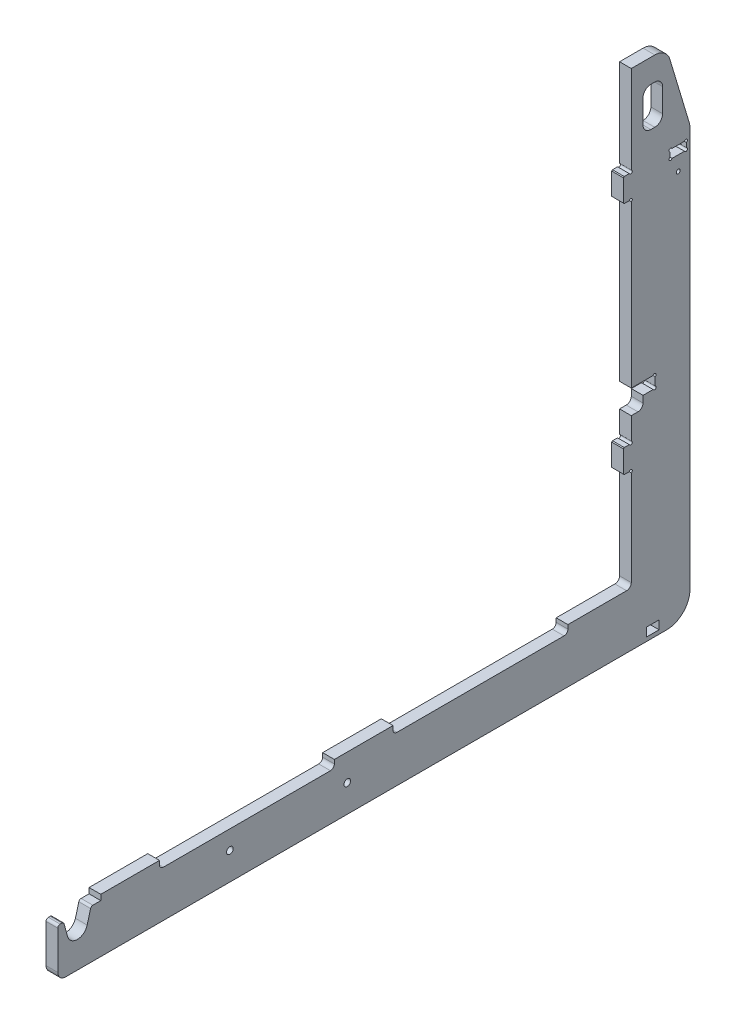
from build123d import *

# Parameters (mm, degrees)
BOSS_EXTRUDE1_DEPTH = 15
FILLET1_R           = 30
FILLET2_R           = 6
SKETCH3_W           = 30.5
SKETCH3_H           = 15.5
CUT_EXTRUDE2_DEPTH  = 820.456527218
SKETCH6_W           = 15
SKETCH6_H           = 30
BOSS_EXTRUDE2_DEPTH = 10
SKETCH7_W           = 15
SKETCH7_H           = 15
CUT_EXTRUDE5_DEPTH  = 820.456527218
FILLET4_R           = 6.5
SKETCH9_W           = 75
SKETCH9_H           = 115
BOSS_EXTRUDE3_DEPTH = 15
SKETCH8_W           = 21
SKETCH8_H           = 11
CUT_EXTRUDE6_DEPTH  = 890.119789455
CUT_EXTRUDE7_DEPTH  = 15
SKETCH11_W          = 25
SKETCH11_H          = 50
CUT_EXTRUDE8_DEPTH  = 15
SKETCH5_R           = 2.5
CUT_EXTRUDE4_DEPTH  = 890.119789455
FILLET5_R           = 20
FILLET6_R           = 10
CHAMFER1_SIZE       = 1
SKETCH12_W          = 16
SKETCH12_H          = 11
CUT_EXTRUDE9_DEPTH  = 890.119789455
SKETCH14_W          = 223.5
SKETCH14_H          = 10
CUT_EXTRUDE11_DEPTH = 15
FILLET8_R           = 5
SKETCH15_R          = 2
CUT_EXTRUDE12_DEPTH = 890.119789455
SKETCH16_R          = 2
CUT_EXTRUDE13_DEPTH = 890.119789455
SKETCH17_R          = 2
CUT_EXTRUDE14_DEPTH = 890.119789455
BOSS_EXTRUDE4_DEPTH = 15
FILLET9_R           = 10
FILLET10_R          = 3
SKETCH19_R          = 4.25
CUT_EXTRUDE15_DEPTH = 932.739770537


with BuildPart() as part:
    # Sketch1 → Boss-Extrude1 (new body)
    with BuildSketch(Plane(origin=(0, 0, 0), x_dir=(0, 0, -1), z_dir=(1, 0, 0))):
        Polygon((-678, 0), (0, 0), (0, 460), (75, 460), (75, -69), (-678, -69), align=None)
    extrude(amount=BOSS_EXTRUDE1_DEPTH)

    # Fillet1
    fillet1_edges = [part.edges().sort_by_distance(p)[0] for p in [
        (7.5, -69, -75),
    ]]
    fillet(fillet1_edges, radius=FILLET1_R)

    # Fillet2
    fillet2_edges = [part.edges().sort_by_distance(p)[0] for p in [
        (7.5, 0, 0),
    ]]
    fillet(fillet2_edges, radius=FILLET2_R)

    # Sketch3 → Cut-Extrude2 (cut, through all)
    with BuildSketch(Plane.ZY):
        with Locations((-15.25, 213.5)):
            Rectangle(SKETCH3_W, SKETCH3_H)
    extrude(amount=-CUT_EXTRUDE2_DEPTH, mode=Mode.SUBTRACT)

    # Sketch6 → Boss-Extrude2 (add)
    with BuildSketch(Plane.XY):
        with Locations((7.5, 445)):
            Rectangle(SKETCH6_W, SKETCH6_H)
        with Locations((7.5, 145)):
            Rectangle(SKETCH6_W, SKETCH6_H)
    extrude(amount=BOSS_EXTRUDE2_DEPTH)

    # Sketch7 → Cut-Extrude5 (cut, through all)
    with BuildSketch(Plane.ZY):
        with Locations((-7.5, 198.25)):
            Rectangle(SKETCH7_W, SKETCH7_H)
    extrude(amount=-CUT_EXTRUDE5_DEPTH, mode=Mode.SUBTRACT)

    # Fillet4
    fillet4_edges = [part.edges().sort_by_distance(p)[0] for p in [
        (7.5, 190.75, -15),
    ]]
    fillet(fillet4_edges, radius=FILLET4_R)

    # Sketch9 → Boss-Extrude3 (add)
    with BuildSketch(Plane(origin=(15, 0, 0), x_dir=(0, 0, -1), z_dir=(1, 0, 0))):
        with Locations((37.5, 517.5)):
            Rectangle(SKETCH9_W, SKETCH9_H)
    extrude(amount=-BOSS_EXTRUDE3_DEPTH)

    # Sketch8 → Cut-Extrude6 (cut, through all)
    with BuildSketch(Plane(origin=(15, 0, 0), x_dir=(0, 0, -1), z_dir=(1, 0, 0))):
        with Locations((60, 455)):
            Rectangle(SKETCH8_W, SKETCH8_H)
    extrude(amount=-CUT_EXTRUDE6_DEPTH, mode=Mode.SUBTRACT)

    # Sketch10 → Cut-Extrude7 (cut)
    with BuildSketch(Plane(origin=(15, 0, 0), x_dir=(0, 0, -1), z_dir=(1, 0, 0))):
        Polygon((45, 575), (75, 475), (75, 575), align=None)
    extrude(amount=-CUT_EXTRUDE7_DEPTH, mode=Mode.SUBTRACT)

    # Sketch11 → Cut-Extrude8 (cut)
    with BuildSketch(Plane(origin=(15, 0, 0), x_dir=(0, 0, -1), z_dir=(1, 0, 0))):
        with Locations((27.5, 520)):
            Rectangle(SKETCH11_W, SKETCH11_H)
    extrude(amount=-CUT_EXTRUDE8_DEPTH, mode=Mode.SUBTRACT)

    # Sketch5 → Cut-Extrude4 (cut, through all)
    with BuildSketch(Plane.ZY):
        with Locations((-60, 431)):
            Circle(SKETCH5_R)
    extrude(amount=-CUT_EXTRUDE4_DEPTH, mode=Mode.SUBTRACT)

    # Fillet5
    fillet5_edges = [part.edges().sort_by_distance(p)[0] for p in [
        (7.5, 575, -45),
        (7.5, 475, -75),
    ]]
    fillet(fillet5_edges, radius=FILLET5_R)

    # Fillet6
    fillet6_edges = [part.edges().sort_by_distance(p)[0] for p in [
        (7.5, 495, -15),
        (7.5, 545, -15),
        (7.5, 545, -40),
        (7.5, 495, -40),
    ]]
    fillet(fillet6_edges, radius=FILLET6_R)

    # Chamfer1
    chamfer1_edges = [part.edges().sort_by_distance(p)[0] for p in [
        (7.5, 430, 10),
        (7.5, 460, 10),
        (7.5, 130, 10),
        (7.5, 160, 10),
    ]]
    chamfer(chamfer1_edges, length=CHAMFER1_SIZE)

    # Sketch12 → Cut-Extrude9 (cut, through all)
    with BuildSketch(Plane(origin=(15, 0, 0), x_dir=(0, 0, -1), z_dir=(1, 0, 0))):
        with Locations((27.5, -58.5)):
            Rectangle(SKETCH12_W, SKETCH12_H)
    extrude(amount=-CUT_EXTRUDE9_DEPTH, mode=Mode.SUBTRACT)

    # Sketch14 → Cut-Extrude11 (cut)
    with BuildSketch(Plane(origin=(15, 0, 0), x_dir=(0, 0, -1), z_dir=(1, 0, 0))):
        with Locations((-491.25, -5)):
            Rectangle(SKETCH14_W, SKETCH14_H)
        with Locations((-192.75, -5)):
            Rectangle(SKETCH14_W, SKETCH14_H)
    extrude(amount=-CUT_EXTRUDE11_DEPTH, mode=Mode.SUBTRACT)

    # Fillet8
    fillet8_edges = [part.edges().sort_by_distance(p)[0] for p in [
        (7.5, -10, 603),
        (7.5, -10, 379.5),
        (7.5, -10, 81),
        (7.5, -10, 304.5),
    ]]
    fillet(fillet8_edges, radius=FILLET8_R)

    # Sketch15 → Cut-Extrude12 (cut, through all)
    with BuildSketch(Plane(origin=(15, 0, 0), x_dir=(0, 0, -1), z_dir=(1, 0, 0))):
        with Locations((-0.707106781, 129.292893219)):
            Circle(SKETCH15_R)
        with Locations((-0.707106781, 160.707106781)):
            Circle(SKETCH15_R)
        with Locations((-0.707106781, 429.292893219)):
            Circle(SKETCH15_R)
        with Locations((-0.707106781, 460.707106781)):
            Circle(SKETCH15_R)
    extrude(amount=-CUT_EXTRUDE12_DEPTH, mode=Mode.SUBTRACT)

    # Sketch16 → Cut-Extrude13 (cut, through all)
    with BuildSketch(Plane(origin=(15, 0, 0), x_dir=(0, 0, -1), z_dir=(1, 0, 0))):
        with Locations((50.207106781, 450.207106781)):
            Circle(SKETCH16_R)
        with Locations((50.207106781, 459.792893219)):
            Circle(SKETCH16_R)
        with Locations((69.792893219, 459.792893219)):
            Circle(SKETCH16_R)
        with Locations((69.792893219, 450.207106781)):
            Circle(SKETCH16_R)
    extrude(amount=-CUT_EXTRUDE13_DEPTH, mode=Mode.SUBTRACT)

    # Sketch17 → Cut-Extrude14 (cut, through all)
    with BuildSketch(Plane(origin=(15, 0, 0), x_dir=(0, 0, -1), z_dir=(1, 0, 0))):
        with Locations((29.792893219, 206.457106781)):
            Circle(SKETCH17_R)
        with Locations((29.792893219, 220.542893219)):
            Circle(SKETCH17_R)
    extrude(amount=-CUT_EXTRUDE14_DEPTH, mode=Mode.SUBTRACT)

    # Sketch18 → Boss-Extrude4 (add)
    with BuildSketch(Plane(origin=(15, 0, 0), x_dir=(0, 0, -1), z_dir=(1, 0, 0))):
        with BuildLine():
            Line((-678, -69), (-733, -69))
            Line((-733, -69), (-733, -7))
            Line((-733, -7), (-725.5, -7))
            Line((-725.5, -7), (-720.55324034, -25.378780397))
            ThreePointArc((-720.55324034, -25.378780397), (-708, -35), (-695.44675966, -25.378780397))
            Line((-695.44675966, -25.378780397), (-690.5, -7))
            Line((-690.5, -7), (-678, -7))
            Line((-678, -7), (-678, -69))
        make_face()
    extrude(amount=-BOSS_EXTRUDE4_DEPTH)

    # Fillet9
    fillet9_edges = [part.edges().sort_by_distance(p)[0] for p in [
        (7.5, -69, 733),
    ]]
    fillet(fillet9_edges, radius=FILLET9_R)

    # Fillet10
    fillet10_edges = [part.edges().sort_by_distance(p)[0] for p in [
        (7.5, -7, 733),
        (7.5, -7, 725.5),
        (7.5, -7, 690.5),
    ]]
    fillet(fillet10_edges, radius=FILLET10_R)

    # Sketch19 → Cut-Extrude15 (cut, through all)
    with BuildSketch(Plane(origin=(15, 0, 0), x_dir=(0, 0, -1), z_dir=(1, 0, 0))):
        with Locations((-513, -34)):
            Circle(SKETCH19_R)
        with Locations((-363, -34)):
            Circle(SKETCH19_R)
    extrude(amount=-CUT_EXTRUDE15_DEPTH, mode=Mode.SUBTRACT)


solid = part.part
